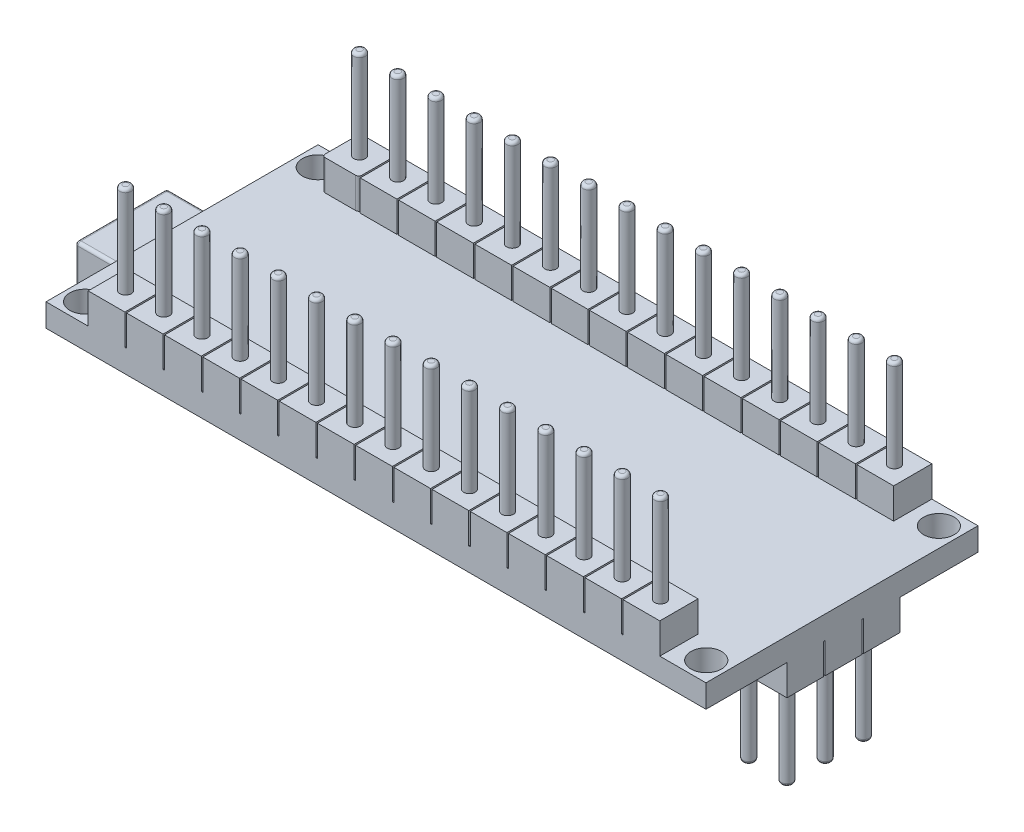
from build123d import *

# Parameters (mm, degrees)
SKETCH1_W           = 43.18
SKETCH1_H           = 17.8
BOSS_EXTRUDE1_DEPTH = 1.5
SKETCH5_R           = 1
CUT_EXTRUDE2_DEPTH  = 6
SKETCH6_W           = 2.4
SKETCH6_H           = 2.5
BOSS_EXTRUDE3_DEPTH = 2
SKETCH7_R           = 0.375
BOSS_EXTRUDE4_DEPTH = 6
FILLET5_R           = 0.2
SKETCH8_W           = 8
SKETCH8_H           = 6
BOSS_EXTRUDE5_DEPTH = 6
SKETCH9_W           = 5
SKETCH9_H           = 5
CUT_EXTRUDE3_DEPTH  = 6
FILLET6_R           = 0.2
SKETCH10_W          = 2.4
SKETCH10_H          = 2.4
BOSS_EXTRUDE6_DEPTH = 2
SKETCH11_R          = 0.375
BOSS_EXTRUDE7_DEPTH = 6
FILLET7_R           = 0.2
FILLET4_R           = 0.2


with BuildPart() as part:
    # Sketch1 → Boss-Extrude1 (new body)
    with BuildSketch(Plane(origin=(0, 0, 0), x_dir=(1, 0, 0), z_dir=(0, 1, 0))):
        Rectangle(SKETCH1_W, SKETCH1_H)
    extrude(amount=BOSS_EXTRUDE1_DEPTH)

    # Sketch5 → Cut-Extrude2 (cut)
    with BuildSketch(Plane(origin=(0, 1.5, 0), x_dir=(1, 0, 0), z_dir=(0, 1, 0))):
        with Locations(Location((-20.32, 7.61, 0), (0, 0, 270))):
            Circle(SKETCH5_R)
        with Locations(Location((20.32, 7.61, 0), (0, 0, 270))):
            Circle(SKETCH5_R)
        with Locations(Location((20.32, -7.61, 0), (0, 0, 270))):
            Circle(SKETCH5_R)
        with Locations(Location((-20.32, -7.61, 0), (0, 0, 270))):
            Circle(SKETCH5_R)
    extrude(amount=-CUT_EXTRUDE2_DEPTH, mode=Mode.SUBTRACT)

    # Sketch6 → Boss-Extrude3 (add)
    with BuildSketch(Plane(origin=(0, 1.5, 0), x_dir=(1, 0, 0), z_dir=(0, 1, 0))):
        with Locations((-17.63, 7.65)):
            Rectangle(SKETCH6_W, SKETCH6_H)
        with Locations((-15.13, 7.65)):
            Rectangle(SKETCH6_W, SKETCH6_H)
        with Locations((-12.63, 7.65)):
            Rectangle(SKETCH6_W, SKETCH6_H)
        with Locations((-10.13, 7.65)):
            Rectangle(SKETCH6_W, SKETCH6_H)
        with Locations((-7.63, 7.65)):
            Rectangle(SKETCH6_W, SKETCH6_H)
        with Locations((-5.13, 7.65)):
            Rectangle(SKETCH6_W, SKETCH6_H)
        with Locations((-2.63, 7.65)):
            Rectangle(SKETCH6_W, SKETCH6_H)
        with Locations((-0.13, 7.65)):
            Rectangle(SKETCH6_W, SKETCH6_H)
        with Locations((2.37, 7.65)):
            Rectangle(SKETCH6_W, SKETCH6_H)
        with Locations((4.87, 7.65)):
            Rectangle(SKETCH6_W, SKETCH6_H)
        with Locations((7.37, 7.65)):
            Rectangle(SKETCH6_W, SKETCH6_H)
        with Locations((9.87, 7.65)):
            Rectangle(SKETCH6_W, SKETCH6_H)
        with Locations((12.37, 7.65)):
            Rectangle(SKETCH6_W, SKETCH6_H)
        with Locations((14.87, 7.65)):
            Rectangle(SKETCH6_W, SKETCH6_H)
        with Locations((17.37, 7.65)):
            Rectangle(SKETCH6_W, SKETCH6_H)
        with Locations((17.37, -7.65)):
            Rectangle(SKETCH6_W, SKETCH6_H)
        with Locations((14.87, -7.65)):
            Rectangle(SKETCH6_W, SKETCH6_H)
        with Locations((12.37, -7.65)):
            Rectangle(SKETCH6_W, SKETCH6_H)
        with Locations((9.87, -7.65)):
            Rectangle(SKETCH6_W, SKETCH6_H)
        with Locations((7.37, -7.65)):
            Rectangle(SKETCH6_W, SKETCH6_H)
        with Locations((4.87, -7.65)):
            Rectangle(SKETCH6_W, SKETCH6_H)
        with Locations((2.37, -7.65)):
            Rectangle(SKETCH6_W, SKETCH6_H)
        with Locations((-0.13, -7.65)):
            Rectangle(SKETCH6_W, SKETCH6_H)
        with Locations((-2.63, -7.65)):
            Rectangle(SKETCH6_W, SKETCH6_H)
        with Locations((-5.13, -7.65)):
            Rectangle(SKETCH6_W, SKETCH6_H)
        with Locations((-7.63, -7.65)):
            Rectangle(SKETCH6_W, SKETCH6_H)
        with Locations((-10.13, -7.65)):
            Rectangle(SKETCH6_W, SKETCH6_H)
        with Locations((-12.63, -7.65)):
            Rectangle(SKETCH6_W, SKETCH6_H)
        with Locations((-15.13, -7.65)):
            Rectangle(SKETCH6_W, SKETCH6_H)
        with Locations((-17.63, -7.65)):
            Rectangle(SKETCH6_W, SKETCH6_H)
    extrude(amount=BOSS_EXTRUDE3_DEPTH)

    # Sketch7 → Boss-Extrude4 (add)
    with BuildSketch(Plane(origin=(0, 3.5, 0), x_dir=(1, 0, 0), z_dir=(0, 1, 0))):
        with Locations(Location((-17.63, 7.654619448, 0), (0, 0, 270))):
            Circle(SKETCH7_R)
        with Locations(Location((-15.13, 7.654619448, 0), (0, 0, 270))):
            Circle(SKETCH7_R)
        with Locations(Location((-12.63, 7.654619448, 0), (0, 0, 270))):
            Circle(SKETCH7_R)
        with Locations(Location((-10.13, 7.654619448, 0), (0, 0, 270))):
            Circle(SKETCH7_R)
        with Locations(Location((-7.63, 7.654619448, 0), (0, 0, 270))):
            Circle(SKETCH7_R)
        with Locations(Location((-5.13, 7.654619448, 0), (0, 0, 270))):
            Circle(SKETCH7_R)
        with Locations(Location((-2.63, 7.654619448, 0), (0, 0, 270))):
            Circle(SKETCH7_R)
        with Locations(Location((-0.13, 7.654619448, 0), (0, 0, 270))):
            Circle(SKETCH7_R)
        with Locations(Location((2.37, 7.654619448, 0), (0, 0, 270))):
            Circle(SKETCH7_R)
        with Locations(Location((4.87, 7.654619448, 0), (0, 0, 270))):
            Circle(SKETCH7_R)
        with Locations(Location((7.37, 7.654619448, 0), (0, 0, 270))):
            Circle(SKETCH7_R)
        with Locations(Location((9.87, 7.654619448, 0), (0, 0, 270))):
            Circle(SKETCH7_R)
        with Locations(Location((12.37, 7.654619448, 0), (0, 0, 270))):
            Circle(SKETCH7_R)
        with Locations(Location((14.87, 7.654619448, 0), (0, 0, 270))):
            Circle(SKETCH7_R)
        with Locations(Location((17.37, 7.654619448, 0), (0, 0, 270))):
            Circle(SKETCH7_R)
        with Locations(Location((17.37, -7.654619448, 0), (0, 0, 90))):
            Circle(SKETCH7_R)
        with Locations(Location((14.87, -7.654619448, 0), (0, 0, 90))):
            Circle(SKETCH7_R)
        with Locations(Location((12.37, -7.654619448, 0), (0, 0, 90))):
            Circle(SKETCH7_R)
        with Locations(Location((9.87, -7.654619448, 0), (0, 0, 90))):
            Circle(SKETCH7_R)
        with Locations(Location((7.37, -7.654619448, 0), (0, 0, 90))):
            Circle(SKETCH7_R)
        with Locations(Location((4.87, -7.654619448, 0), (0, 0, 90))):
            Circle(SKETCH7_R)
        with Locations(Location((2.37, -7.654619448, 0), (0, 0, 90))):
            Circle(SKETCH7_R)
        with Locations(Location((-0.13, -7.654619448, 0), (0, 0, 90))):
            Circle(SKETCH7_R)
        with Locations(Location((-2.63, -7.654619448, 0), (0, 0, 90))):
            Circle(SKETCH7_R)
        with Locations(Location((-5.13, -7.654619448, 0), (0, 0, 90))):
            Circle(SKETCH7_R)
        with Locations(Location((-7.63, -7.654619448, 0), (0, 0, 90))):
            Circle(SKETCH7_R)
        with Locations(Location((-10.13, -7.654619448, 0), (0, 0, 90))):
            Circle(SKETCH7_R)
        with Locations(Location((-12.63, -7.654619448, 0), (0, 0, 90))):
            Circle(SKETCH7_R)
        with Locations(Location((-15.13, -7.654619448, 0), (0, 0, 90))):
            Circle(SKETCH7_R)
        with Locations(Location((-17.63, -7.654619448, 0), (0, 0, 90))):
            Circle(SKETCH7_R)
    extrude(amount=BOSS_EXTRUDE4_DEPTH)

    # Fillet5
    fillet5_edges = [part.edges().sort_by_distance(p)[0] for p in [
        (-17.63, 9.5, -8.029619448),
        (-15.13, 9.5, -8.029619448),
        (-12.63, 9.5, -8.029619448),
        (-10.13, 9.5, -8.029619448),
        (-7.63, 9.5, -8.029619448),
        (-5.13, 9.5, -8.029619448),
        (-2.63, 9.5, -8.029619448),
        (-0.13, 9.5, -8.029619448),
        (2.37, 9.5, -8.029619448),
        (4.87, 9.5, -8.029619448),
        (7.37, 9.5, -8.029619448),
        (9.87, 9.5, -8.029619448),
        (12.37, 9.5, -8.029619448),
        (14.87, 9.5, -8.029619448),
        (17.37, 9.5, -8.029619448),
        (17.37, 9.5, 8.029619448),
        (14.87, 9.5, 8.029619448),
        (12.37, 9.5, 8.029619448),
        (9.87, 9.5, 8.029619448),
        (7.37, 9.5, 8.029619448),
        (4.87, 9.5, 8.029619448),
        (2.37, 9.5, 8.029619448),
        (-0.13, 9.5, 8.029619448),
        (-2.63, 9.5, 8.029619448),
        (-5.13, 9.5, 8.029619448),
        (-7.63, 9.5, 8.029619448),
        (-10.13, 9.5, 8.029619448),
        (-12.63, 9.5, 8.029619448),
        (-15.13, 9.5, 8.029619448),
        (-17.63, 9.5, 8.029619448),
    ]]
    fillet(fillet5_edges, radius=FILLET5_R)

    # Sketch8 → Boss-Extrude5 (add)
    with BuildSketch(Plane.XZ):
        with Locations((-21.59, 0)):
            Rectangle(SKETCH8_W, SKETCH8_H)
    extrude(amount=BOSS_EXTRUDE5_DEPTH)

    # Sketch9 → Cut-Extrude3 (cut)
    with BuildSketch(Plane.ZY.offset(25.59)):
        with Locations((0, -3)):
            Rectangle(SKETCH9_W, SKETCH9_H)
    extrude(amount=-CUT_EXTRUDE3_DEPTH, mode=Mode.SUBTRACT)

    # Fillet6
    fillet6_edges = [part.edges().sort_by_distance(p)[0] for p in [
        (-25.59, -3, 3),
        (-25.59, -6, 0),
        (-25.59, -3, -3),
        (-25.59, 0, 0),
        (-25.59, -0.5, 0),
        (-25.59, -3, -2.5),
        (-25.59, -5.5, 0),
        (-25.59, -3, 2.5),
        (-17.59, -3, 3),
        (-17.59, -3, -3),
        (-17.59, -6, 0),
        (-21.59, -6, -3),
        (-21.59, -6, 3),
        (-23.59, 0, -3),
        (-23.59, 0, 3),
    ]]
    fillet(fillet6_edges, radius=FILLET6_R)

    # Sketch10 → Boss-Extrude6 (add)
    with BuildSketch(Plane.XZ):
        with Locations((20.39, -2.6)):
            Rectangle(SKETCH10_W, SKETCH10_H)
        with Locations((17.89, -2.6)):
            Rectangle(SKETCH10_W, SKETCH10_H)
        with Locations((17.89, -0.1)):
            Rectangle(SKETCH10_W, SKETCH10_H)
        with Locations((17.89, 2.4)):
            Rectangle(SKETCH10_W, SKETCH10_H)
        with Locations((20.39, -0.1)):
            Rectangle(SKETCH10_W, SKETCH10_H)
        with Locations((20.39, 2.4)):
            Rectangle(SKETCH10_W, SKETCH10_H)
    extrude(amount=BOSS_EXTRUDE6_DEPTH)

    # Sketch11 → Boss-Extrude7 (add)
    with BuildSketch(Plane.XZ.offset(2)):
        with Locations(Location((20.39, -2.6, 0), (0, 0, 270))):
            Circle(SKETCH11_R)
        with Locations(Location((17.89, -2.6, 0), (0, 0, 270))):
            Circle(SKETCH11_R)
        with Locations(Location((17.89, -0.1, 0), (0, 0, 270))):
            Circle(SKETCH11_R)
        with Locations(Location((17.89, 2.4, 0), (0, 0, 270))):
            Circle(SKETCH11_R)
        with Locations(Location((20.39, -0.1, 0), (0, 0, 270))):
            Circle(SKETCH11_R)
        with Locations(Location((20.39, 2.4, 0), (0, 0, 270))):
            Circle(SKETCH11_R)
    extrude(amount=BOSS_EXTRUDE7_DEPTH)

    # Fillet7
    fillet7_edges = [part.edges().sort_by_distance(p)[0] for p in [
        (20.39, -8, -2.225),
        (17.89, -8, -2.225),
        (17.89, -8, 0.275),
        (17.89, -8, 2.775),
        (20.39, -8, 0.275),
        (20.39, -8, 2.775),
    ]]
    fillet(fillet7_edges, radius=FILLET7_R)

    # Fillet4
    fillet4_edges = [part.edges().sort_by_distance(p)[0] for p in [
        (-16.43, 2.5, -6.4),
        (-16.43, 2.5, -8.9),
        (-18.83, 2.5, -6.4),
        (-18.83, 2.5, -8.9),
    ]]
    fillet(fillet4_edges, radius=FILLET4_R)


solid = part.part
